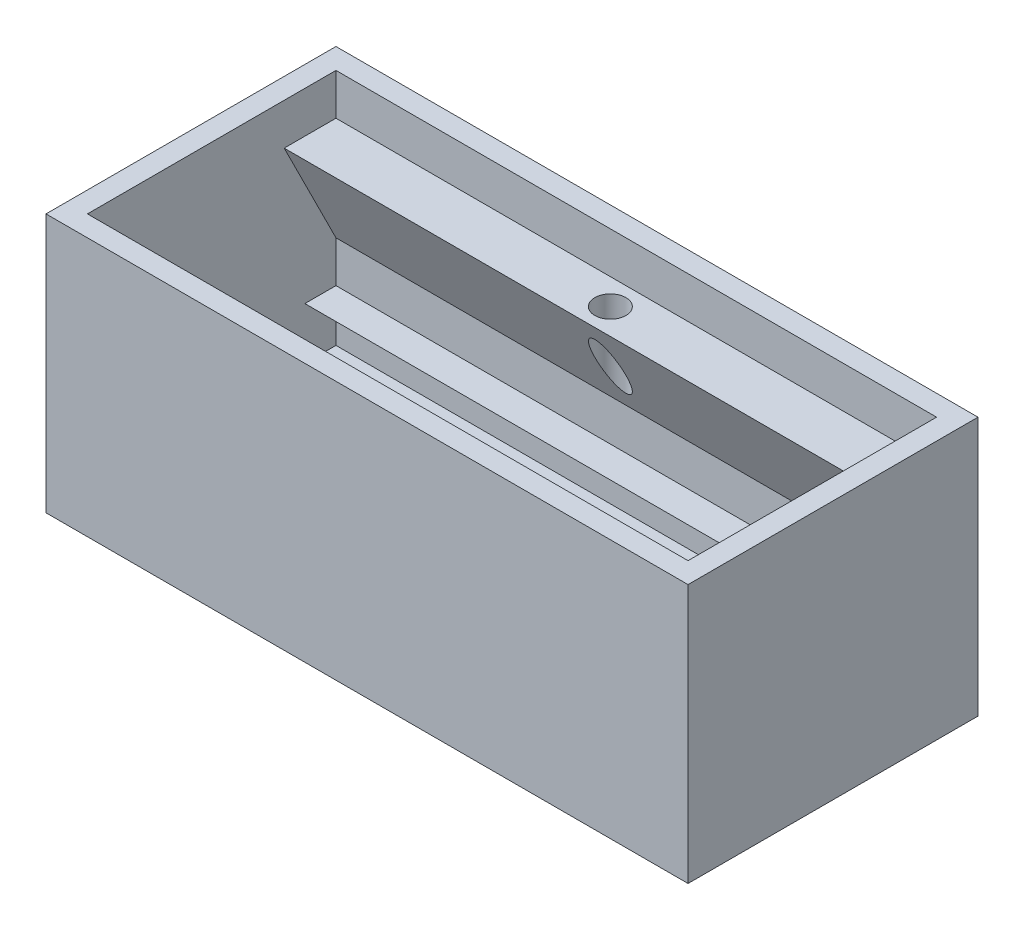
from build123d import *

# Parameters (mm, degrees)
SKETCH1_W                      = 62
SKETCH1_H                      = 28
BOSS_EXTRUDE1_DEPTH            = 25
SKETCH2_W                      = 58
SKETCH2_H                      = 24
CUT_EXTRUDE1_DEPTH             = 23
BOSS_EXTRUDE3_DEPTH            = 58
F_1_5_1_5_DIAMETER_HOLE1_D     = 1.5
F_2_0_2_DIAMETER_HOLE1_D       = 2
F_2_0_2_DIAMETER_HOLE1_DEPTH   = 2
F_3_5_3_5_DIAMETER_HOLE1_D     = 3.5
F_3_5_3_5_DIAMETER_HOLE1_DEPTH = 2
BOSS_EXTRUDE4_REACH            = 72.774
F_3_0_3_DIAMETER_HOLE1_REACH   = 73.197
F_3_0_3_DIAMETER_HOLE1_BORE_R  = 1.5


with BuildPart() as part:
    # Sketch1 → Boss-Extrude1 (new body)
    with BuildSketch(Plane(origin=(0, 0, 0), x_dir=(1, 0, 0), z_dir=(0, 1, 0))):
        with Locations((31, 14)):
            Rectangle(SKETCH1_W, SKETCH1_H)
    extrude(amount=BOSS_EXTRUDE1_DEPTH)

    # Sketch2 → Cut-Extrude1 (cut)
    with BuildSketch(Plane(origin=(0, 25, 0), x_dir=(1, 0, 0), z_dir=(0, 1, 0))):
        with Locations((31, 14)):
            Rectangle(SKETCH2_W, SKETCH2_H)
    extrude(amount=-CUT_EXTRUDE1_DEPTH, mode=Mode.SUBTRACT)

    # Sketch3 → Boss-Extrude3 (add)
    with BuildSketch(Plane(origin=(2, 0, 0), x_dir=(0, 0, -1), z_dir=(1, 0, 0))):
        Polygon((26, 11), (21, 21), (26, 21), align=None)
    extrude(amount=BOSS_EXTRUDE3_DEPTH)

    # Ø1.5 (1.5) Diameter Hole1 (through all)
    with Locations(Plane(origin=(0, 0, 0), x_dir=(-1, 0, 0), z_dir=(0, -1, 0))):
        with Locations((-7.5, 7.5), (-5.5, 7.5), (-3.5, 7.5)):
            Hole(F_1_5_1_5_DIAMETER_HOLE1_D / 2)

    # Ø2.0 (2) Diameter Hole1
    with Locations(Plane(origin=(0, 0, 0), x_dir=(-1, 0, 0), z_dir=(0, -1, 0))):
        with Locations((-53, 21)):
            Hole(F_2_0_2_DIAMETER_HOLE1_D / 2, depth=F_2_0_2_DIAMETER_HOLE1_DEPTH)

    # Ø3.5 (3.5) Diameter Hole1
    with Locations(Plane(origin=(0, 0, 0), x_dir=(-1, 0, 0), z_dir=(0, -1, 0))):
        with Locations((-40, 22)):
            Hole(F_3_5_3_5_DIAMETER_HOLE1_D / 2, depth=F_3_5_3_5_DIAMETER_HOLE1_DEPTH)

    # Sketch10 → Boss-Extrude4 (add, up to next)
    with BuildSketch(Plane(origin=(2, 0, 0), x_dir=(0, 0, -1), z_dir=(1, 0, 0)), mode=Mode.PRIVATE) as boss_extrude4_sk1:
        Polygon((26, 4), (23, 7), (26, 7), align=None)
    boss_extrude4_tool1 = extrude(boss_extrude4_sk1.sketch, amount=BOSS_EXTRUDE4_REACH, mode=Mode.PRIVATE) - part.part
    add(boss_extrude4_tool1.solids().sort_by_distance((2, 6, -25))[0])

    # Ø3.0 (3) Diameter Hole1 bore → Ø3.0 (3) Diameter Hole1 (cut, up to next)
    with BuildSketch(Plane(origin=(0, 21, 0), x_dir=(1, 0, 0), z_dir=(0, 1, 0)), mode=Mode.PRIVATE) as f_3_0_3_diameter_hole1_sk1:
        with Locations((31, 23.5)):
            Circle(F_3_0_3_DIAMETER_HOLE1_BORE_R)
    f_3_0_3_diameter_hole1_tool1 = extrude(f_3_0_3_diameter_hole1_sk1.sketch, amount=-F_3_0_3_DIAMETER_HOLE1_REACH, mode=Mode.PRIVATE) & part.part
    add(f_3_0_3_diameter_hole1_tool1.solids().sort_by_distance((31, 21, -23.5))[0], mode=Mode.SUBTRACT)


solid = part.part
